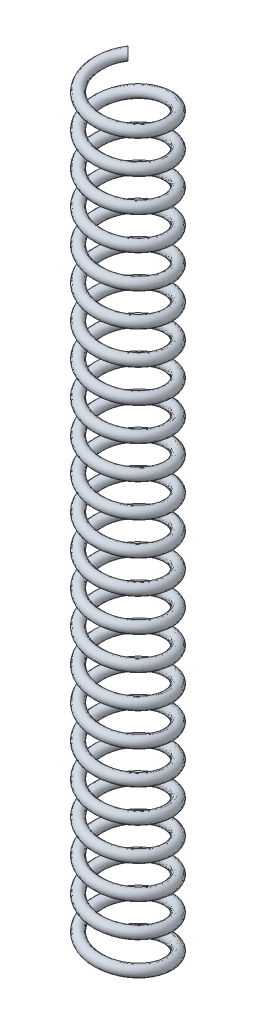
from build123d import *

# Parameters (mm, degrees)
SWEEP1_PITCH       = 2.173913043
SWEEP1_HEIGHT      = 50
SWEEP1_RADIUS      = 2.325
SWEEP1_START_ANGLE = -135
SKETCH2_R          = 0.35


with BuildPart() as part:
    # Sweep1: sweep along a helix
    with BuildLine() as sweep1_path:
        add(Helix(SWEEP1_PITCH, SWEEP1_HEIGHT, SWEEP1_RADIUS, center=(0, 0, 0), direction=(0, 1, 0), lefthand=True, mode=Mode.PRIVATE).rotate(Axis((0, 0, 0), (0, 1, 0)), SWEEP1_START_ANGLE))
    # Sketch2 → Sweep1 (sweep)
    with BuildSketch(Plane(origin=(0, 0, 0), x_dir=(-0.7071067811865536, 0, -0.7071067811865416), z_dir=(0.7071067811865416, 0, -0.7071067811865536))):
        with Locations((2.325, 50)):
            Circle(SKETCH2_R)
    sweep(path=sweep1_path.line, is_frenet=True)


solid = part.part
